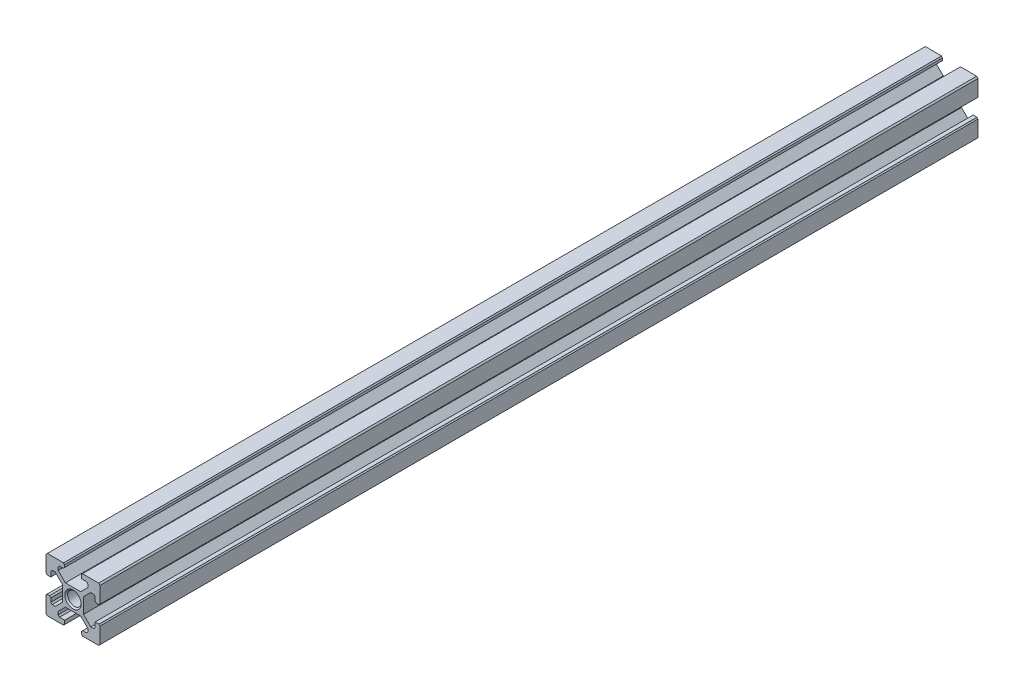
from build123d import *

# Parameters (mm, degrees)
BOSS_EXTRUDE1_DEPTH             = 325
M6X1_0_TAPPED_HOLE2_D           = 5
M6X1_0_TAPPED_HOLE2_DEPTH       = 28.497848452
M6X1_0_TAPPED_HOLE2_CSINK_D     = 6.05
M6X1_0_TAPPED_HOLE2_CSINK_ANGLE = 90
M6X1_0_TAPPED_HOLE2_TIP         = 1.502151548


with BuildPart() as part:
    # Sketch1 → Boss-Extrude1 (new body)
    with BuildSketch(Plane.XY):
        with BuildLine():
            Line((-9.5, 10), (-3.486470896, 10))
            ThreePointArc((-3.486470896, 10), (-3.373276191, 9.726723809), (-3.1, 9.613529104))
            Line((-3.1, 9.613529104), (-3.1, 8.7))
            Line((-3.1, 8.7), (-3.6, 8.2))
            Line((-3.6, 8.2), (-5, 8.2))
            Line((-5, 8.2), (-5.5, 7.7))
            Line((-5.5, 7.7), (-5.5, 6.560660172))
            Line((-5.5, 6.560660172), (-2.839339828, 3.9))
            Line((-2.839339828, 3.9), (0, 3.9))
            Line((0, 3.9), (2.839339828, 3.9))
            Line((2.839339828, 3.9), (5.5, 6.560660172))
            Line((5.5, 6.560660172), (5.5, 7.7))
            Line((5.5, 7.7), (5, 8.2))
            Line((5, 8.2), (3.1, 8.2))
            Line((3.1, 8.2), (3.1, 9.613529104))
            ThreePointArc((3.1, 9.613529104), (3.373276191, 9.726723809), (3.486470896, 10))
            Line((3.486470896, 10), (9.5, 10))
            Line((9.5, 10), (10, 9.5))
            Line((10, 9.5), (10, 3.486470896))
            ThreePointArc((10, 3.486470896), (9.726723809, 3.373276191), (9.613529104, 3.1))
            Line((9.613529104, 3.1), (8.7, 3.1))
            Line((8.7, 3.1), (8.2, 3.6))
            Line((8.2, 3.6), (8.2, 5))
            Line((8.2, 5), (7.7, 5.5))
            Line((7.7, 5.5), (6.560660172, 5.5))
            Line((6.560660172, 5.5), (3.9, 2.839339828))
            Line((3.9, 2.839339828), (3.9, 0))
            Line((3.9, 0), (3.9, -2.839339828))
            Line((3.9, -2.839339828), (6.560660172, -5.5))
            Line((6.560660172, -5.5), (7.7, -5.5))
            Line((7.7, -5.5), (8.2, -5))
            Line((8.2, -5), (8.2, -3.1))
            Line((8.2, -3.1), (9.613529104, -3.1))
            ThreePointArc((9.613529104, -3.1), (9.726723809, -3.373276191), (10, -3.486470896))
            Line((10, -3.486470896), (10, -9.5))
            Line((10, -9.5), (9.5, -10))
            Line((9.5, -10), (3.486470896, -10))
            ThreePointArc((3.486470896, -10), (3.373276191, -9.726723809), (3.1, -9.613529104))
            Line((3.1, -9.613529104), (3.1, -8.7))
            Line((3.1, -8.7), (3.6, -8.2))
            Line((3.6, -8.2), (5, -8.2))
            Line((5, -8.2), (5.5, -7.7))
            Line((5.5, -7.7), (5.5, -6.560660172))
            Line((5.5, -6.560660172), (2.839339828, -3.9))
            Line((2.839339828, -3.9), (0, -3.9))
            Line((0, -3.9), (-2.839339828, -3.9))
            Line((-2.839339828, -3.9), (-5.5, -6.560660172))
            Line((-5.5, -6.560660172), (-5.5, -7.7))
            Line((-5.5, -7.7), (-5, -8.2))
            Line((-5, -8.2), (-3.1, -8.2))
            Line((-3.1, -8.2), (-3.1, -9.613529104))
            ThreePointArc((-3.1, -9.613529104), (-3.373276191, -9.726723809), (-3.486470896, -10))
            Line((-3.486470896, -10), (-9.5, -10))
            Line((-9.5, -10), (-10, -9.5))
            Line((-10, -9.5), (-10, -3.486470896))
            ThreePointArc((-10, -3.486470896), (-9.726723809, -3.373276191), (-9.613529104, -3.1))
            Line((-9.613529104, -3.1), (-8.7, -3.1))
            Line((-8.7, -3.1), (-8.2, -3.6))
            Line((-8.2, -3.6), (-8.2, -5))
            Line((-8.2, -5), (-7.7, -5.5))
            Line((-7.7, -5.5), (-6.560660172, -5.5))
            Line((-6.560660172, -5.5), (-3.9, -2.839339828))
            Line((-3.9, -2.839339828), (-3.9, 0))
            Line((-3.9, 0), (-3.9, 2.839339828))
            Line((-3.9, 2.839339828), (-6.560660172, 5.5))
            Line((-6.560660172, 5.5), (-7.7, 5.5))
            Line((-7.7, 5.5), (-8.2, 5))
            Line((-8.2, 5), (-8.2, 3.1))
            Line((-8.2, 3.1), (-9.613529104, 3.1))
            ThreePointArc((-9.613529104, 3.1), (-9.726723809, 3.373276191), (-10, 3.486470896))
            Line((-10, 3.486470896), (-10, 9.5))
            Line((-10, 9.5), (-9.5, 10))
        make_face()
    extrude(amount=BOSS_EXTRUDE1_DEPTH)

    # Sketch2 → M6x1.0 Tapped Hole1 (revolve, cut)
    with BuildSketch(Plane(origin=(0, 0, 325), x_dir=(0, -1, 0), z_dir=(1, 0, 0))):
        Polygon((0, 0), (0, 30), (2.5, 28.497848452), (2.5, 0.525), (3.025, 0), align=None)
    revolve(axis=Axis((0, 0, 331.35), (0, 0, -1)), mode=Mode.SUBTRACT)

    # M6x1.0 Tapped Hole2
    with Locations(Plane(origin=(0, 0, 0), x_dir=(-1, 0, 0), z_dir=(0, 0, -1))):
        with Locations((0, 0)):
            CounterSinkHole(M6X1_0_TAPPED_HOLE2_D / 2, M6X1_0_TAPPED_HOLE2_CSINK_D / 2, depth=M6X1_0_TAPPED_HOLE2_DEPTH, counter_sink_angle=M6X1_0_TAPPED_HOLE2_CSINK_ANGLE)
            with Locations((0, 0, -(M6X1_0_TAPPED_HOLE2_DEPTH + M6X1_0_TAPPED_HOLE2_TIP / 2))):  # 118° drill point
                Cone(0, M6X1_0_TAPPED_HOLE2_D / 2, M6X1_0_TAPPED_HOLE2_TIP, mode=Mode.SUBTRACT)


solid = part.part
